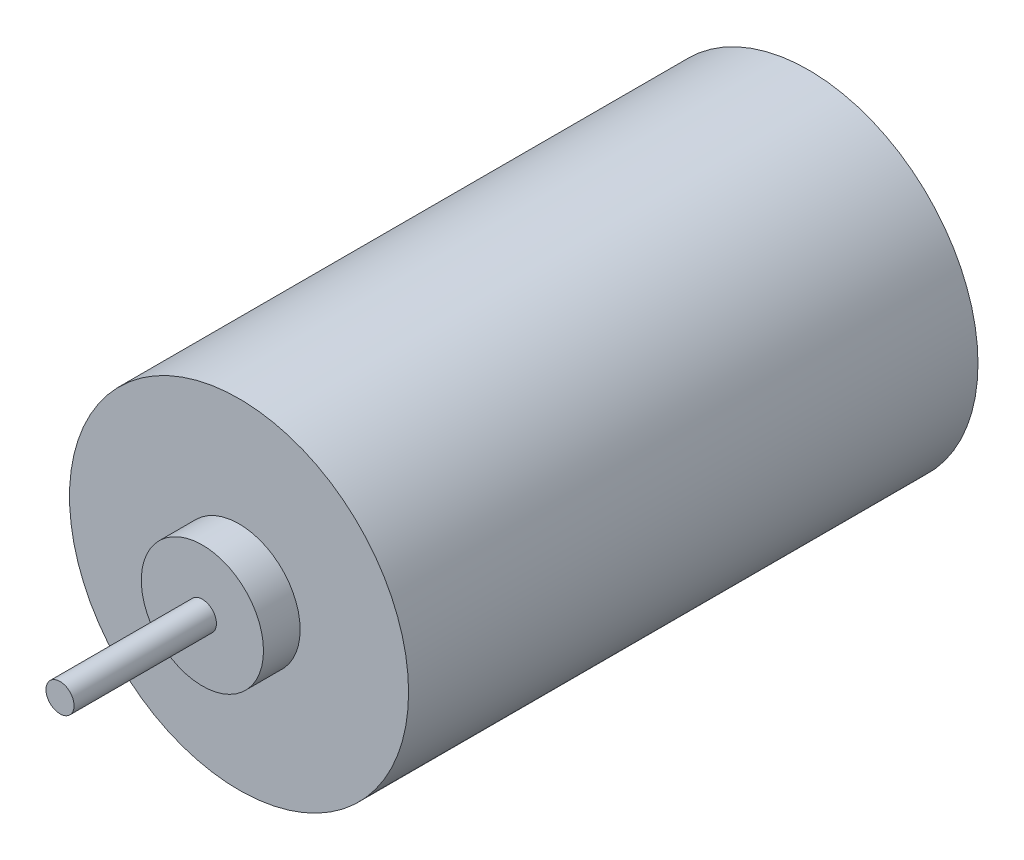
from build123d import *

# Parameters (mm, degrees)
SKETCH1_R           = 13.875
BOSS_EXTRUDE1_DEPTH = 46.6
SKETCH2_R           = 5
BOSS_EXTRUDE2_DEPTH = 3
SKETCH3_R           = 1.15
BOSS_EXTRUDE3_DEPTH = 11.65


with BuildPart() as part:
    # Sketch1 → Boss-Extrude1 (new body)
    with BuildSketch(Plane.XY):
        Circle(SKETCH1_R)
    extrude(amount=BOSS_EXTRUDE1_DEPTH)

    # Sketch2 → Boss-Extrude2 (add)
    with BuildSketch(Plane.XY.offset(46.6)):
        Circle(SKETCH2_R)
    extrude(amount=BOSS_EXTRUDE2_DEPTH)

    # Sketch3 → Boss-Extrude3 (add)
    with BuildSketch(Plane.XY.offset(49.6)):
        Circle(SKETCH3_R)
    extrude(amount=BOSS_EXTRUDE3_DEPTH)


solid = part.part
